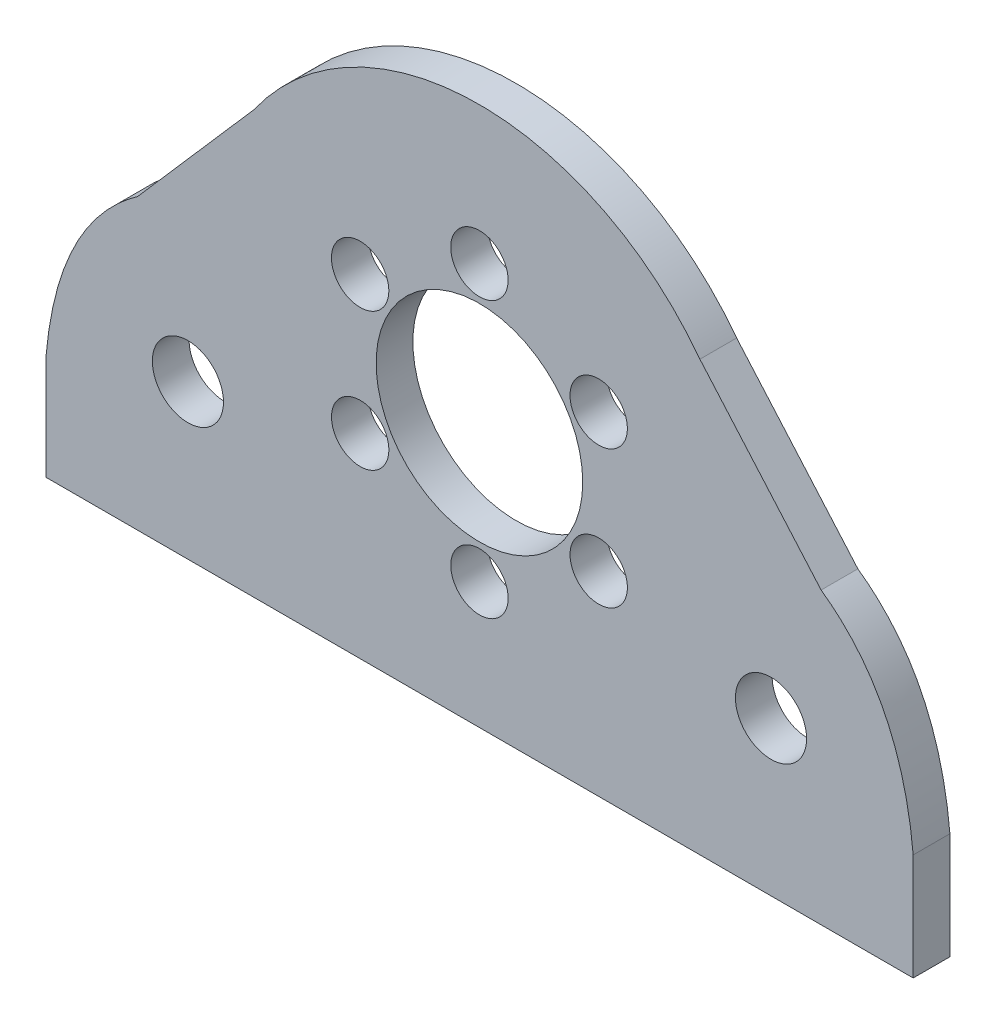
from build123d import *

# Parameters (mm, degrees)
CROQUIS1_R              = 4.5
CROQUIS1_R_2            = 1.249999997
CROQUIS1_R_3            = 1.25
CROQUIS1_R_4            = 1.250000007
CROQUIS1_R_5            = 1.55
SALIENTE_EXTRUIR1_DEPTH = 1.6


with BuildPart() as part:
    # Croquis1 → Saliente-Extruir1 (new body)
    with BuildSketch(Plane.XY):
        with BuildLine():
            Line((-18.876999997, -10.553790007), (18.892053472, -10.553790007))
            Line((18.892053472, -10.553790007), (18.892053472, -5.910945686))
            add(Edge.make_bspline(
                [(18.892053472, -5.910945686), (18.378347588, -0.392416566), (14.881416045, 2.073879198)],
                knots=[0, 0, 0, 0.734097382, 0.734097382, 0.734097382], degree=2))
            Line((14.881416045, 2.073879198), (9.601527182, 8.142540641))
            ThreePointArc((9.601527182, 8.142540641), (-0.182204471, 12.944844806), (-9.816792732, 7.849407753))
            Line((-9.816792732, 7.849407753), (-14.886628426, 2.036126845))
            add(Edge.make_bspline(
                [(-18.876999997, -5.958845057), (-18.377293132, -0.43903071), (-14.886628426, 2.036126845)],
                knots=[0, 0, 0, 0.734097382, 0.734097382, 0.734097382], degree=2))
            Line((-18.876999997, -5.958845057), (-18.876999997, -10.553790007))
        make_face()
        with Locations((-0.0012, 0.946209993)):
            Circle(CROQUIS1_R, mode=Mode.SUBTRACT)
        with Locations((-0.0024, 6.945010003)):
            Circle(CROQUIS1_R_2, mode=Mode.SUBTRACT)
        with Locations((5.193313192, 3.946649223)):
            Circle(CROQUIS1_R_3, mode=Mode.SUBTRACT)
        with Locations((5.194513192, -2.052150777)):
            Circle(CROQUIS1_R_3, mode=Mode.SUBTRACT)
        with Locations((0, -5.052590007)):
            Circle(CROQUIS1_R_3, mode=Mode.SUBTRACT)
        with Locations((-5.195713192, -2.054229238)):
            Circle(CROQUIS1_R_3, mode=Mode.SUBTRACT)
        with Locations((-5.196913248, 3.944570795)):
            Circle(CROQUIS1_R_4, mode=Mode.SUBTRACT)
        with Locations((12.6988, -3.853790007)):
            Circle(CROQUIS1_R_5, mode=Mode.SUBTRACT)
        with Locations((-12.6988, -3.853790007)):
            Circle(CROQUIS1_R_5, mode=Mode.SUBTRACT)
    extrude(amount=SALIENTE_EXTRUIR1_DEPTH)


solid = part.part
